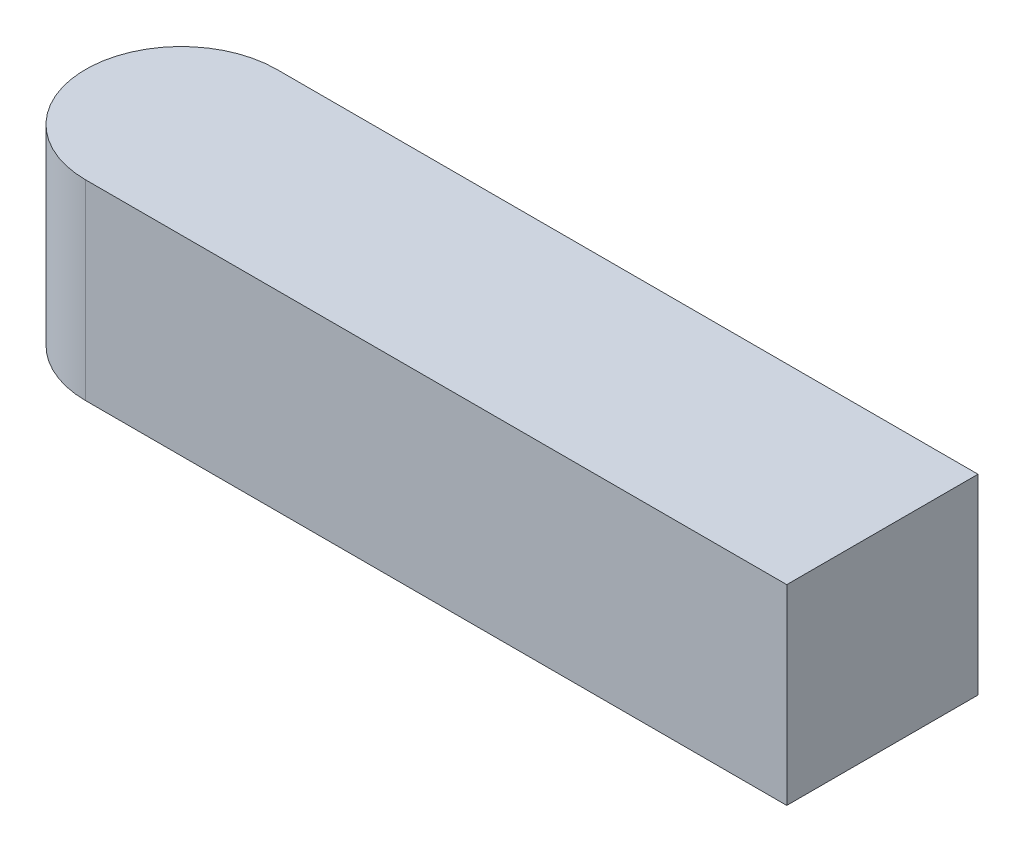
from build123d import *

# Parameters (mm, degrees)
BOSS_EXTRUDE1_DEPTH = 12
SKETCH2_W           = 50
SKETCH2_H           = 12
CUT_EXTRUDE1_DEPTH  = 52.768716422


with BuildPart() as part:
    # Sketch1 → Boss-Extrude1 (new body)
    with BuildSketch(Plane(origin=(0, 0, 0), x_dir=(1, 0, 0), z_dir=(0, 1, 0))):
        with BuildLine():
            Line((-44, 6), (44, 6))
            ThreePointArc((44, 6), (50, 0), (44, -6))
            Line((44, -6), (-44, -6))
            ThreePointArc((-44, -6), (-50, 0), (-44, 6))
        make_face()
    extrude(amount=BOSS_EXTRUDE1_DEPTH)

    # Sketch2 → Cut-Extrude1 (cut, through all)
    with BuildSketch(Plane(origin=(0, 12, 0), x_dir=(1, 0, 0), z_dir=(0, 1, 0))):
        with Locations((25, 0)):
            Rectangle(SKETCH2_W, SKETCH2_H)
    extrude(amount=-CUT_EXTRUDE1_DEPTH, mode=Mode.SUBTRACT)


solid = part.part
